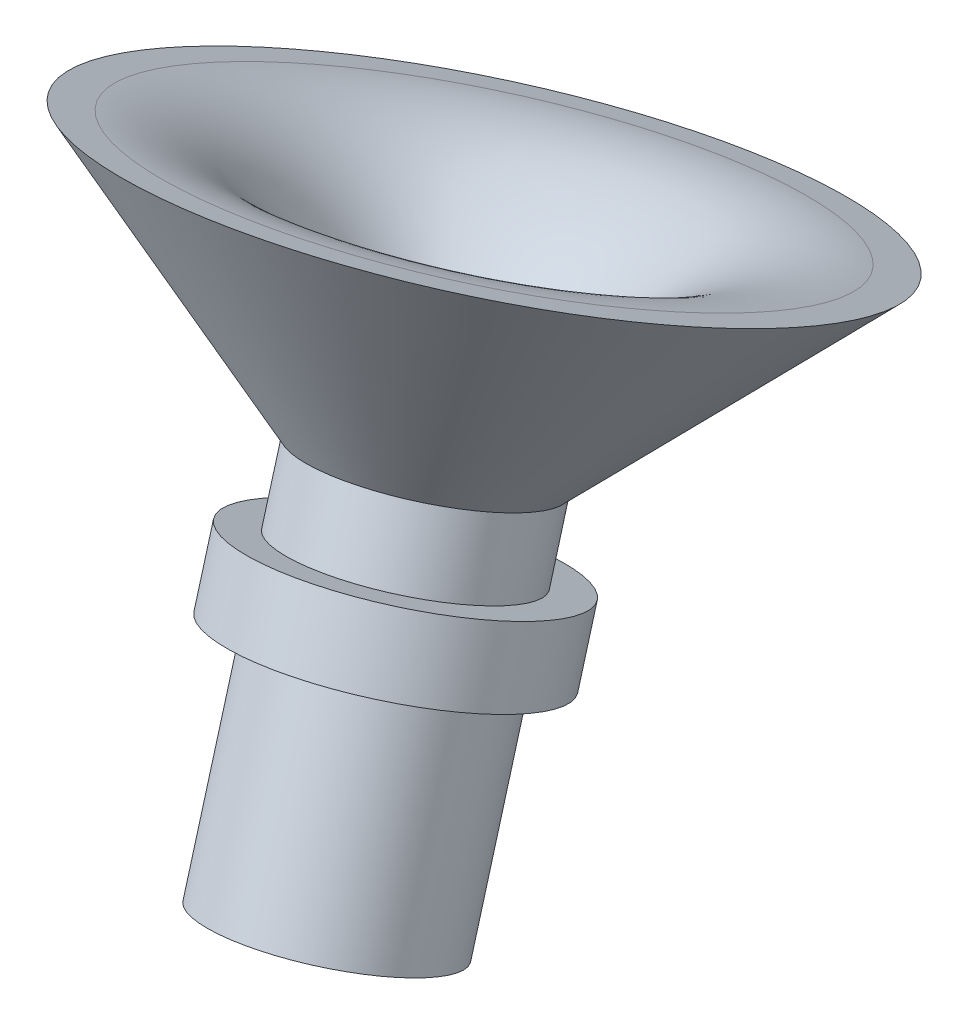
from build123d import *


with BuildPart() as part:
    # Inlet Fairlead Liner Profile → Inlet Fairlead Liner Feature (revolve)
    with BuildSketch(Plane(origin=(3.258206564, -5.512003586, 12.159792439), x_dir=(0.9714880974430896, 0.09788446030256422, -0.21593866943574938), z_dir=(0.23708833064156934, -0.4010892811605493, 0.8848256958360261)), mode=Mode.PRIVATE) as inlet_fairlead_liner_feature_sk:
        with BuildLine():
            Line((-23.152018399, -30.892753147), (-23.579443274, -34.869851081))
            Line((-23.579443274, -34.869851081), (-22.634882515, -34.971364489))
            Line((-22.634882515, -34.971364489), (-23.062307391, -38.948462423))
            add(Edge.make_bspline(
                [(-23.062307391, -38.948462423), (-23.13354487, -39.611312079), (-24.199056833, -40.167305516), (-24.270294312, -40.830155171)],
                knots=[0, 0, 0, 0, 1, 1, 1, 1], degree=3))
            ThreePointArc((-24.270294312, -40.830155171), (-26.470944377, -44.860719778), (-30.877078526, -46.154664759))
            Line((-30.877078526, -46.154664759), (-31.871353009, -46.04780854))
            Line((-31.871353009, -46.04780854), (-25.165141347, -40.733984574))
            Line((-25.165141347, -40.733984574), (-24.951428909, -38.745435607))
            Line((-24.951428909, -38.745435607), (-25.945703393, -38.638579389))
            Line((-25.945703393, -38.638579389), (-25.731990955, -36.650030422))
            Line((-25.731990955, -36.650030422), (-24.737716471, -36.75688664))
            Line((-24.737716471, -36.75688664), (-24.096579158, -30.79123974))
            Line((-24.096579158, -30.79123974), (-23.152018399, -30.892753147))
        make_face()
    revolve(inlet_fairlead_liner_feature_sk.sketch.rotate(Axis((-17.253555798, -35.915165888, 3.874224953), (-0.10380954475082989, -0.9160389667138149, -0.38742249532069234)), 283.790724011), axis=Axis((-17.253555798, -35.915165888, 3.874224953), (-0.10380954475082989, -0.9160389667138149, -0.38742249532069234)))


with BuildPart() as body_2:
    # Mirror1: mirrored copy
    add(part.part.mirror(Plane(origin=(0, 0, 0), x_dir=(0, 0, 1), z_dir=(0, -1, 0))))


solid = body_2.part
